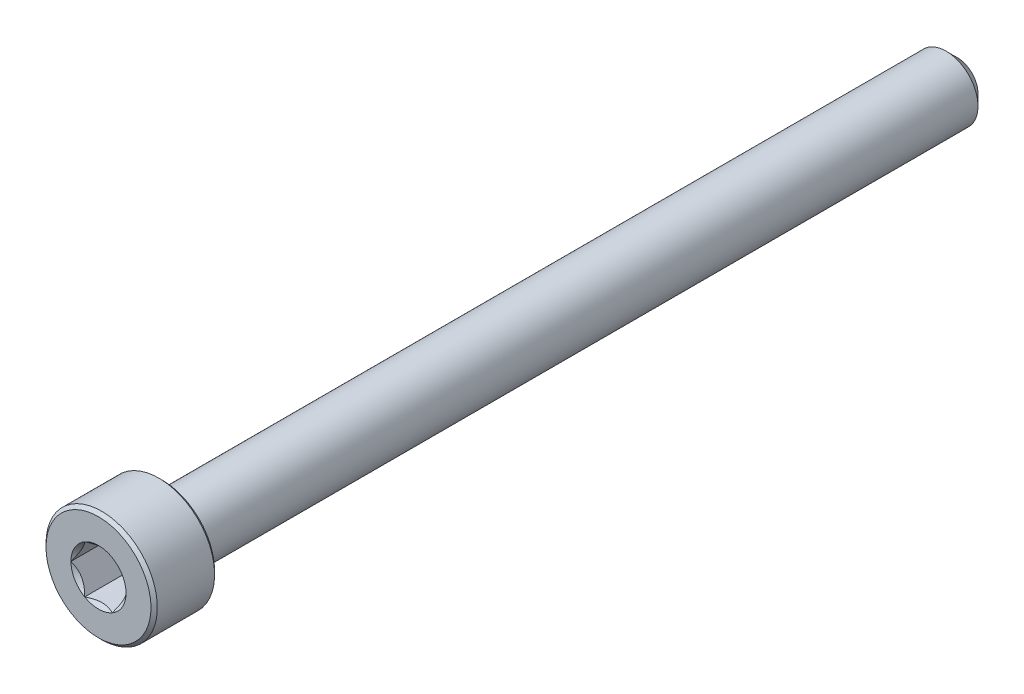
from build123d import *

# Parameters (mm, degrees)
CUT_EXTRUDE1_DEPTH = 3


with BuildPart() as part:
    # Sketch2 → Revolve1 (revolve)
    with BuildSketch(Plane(origin=(0, 0, 0), x_dir=(0, 0, -1), z_dir=(1, 0, 0)), mode=Mode.PRIVATE) as revolve1_sk:
        Polygon((-27, 0), (-27, 3.3), (-26.8, 3.5), (-23.2, 3.5), (-23, 3.3), (-23, 2), (26.3, 2), (27, 1.3), (27, 0), align=None)
    revolve(revolve1_sk.sketch.rotate(Axis((0, 0, -27), (0, 0, 1)), 90), axis=Axis((0, 0, -27), (0, 0, 1)))

    # Sketch3 → Cut-Extrude1 (cut)
    with BuildSketch(Plane.XY.offset(27)):
        Polygon((0.866025404, 1.5), (-0.866025404, 1.5), (-1.732050808, 0), (-0.866025404, -1.5), (0.866025404, -1.5), (1.732050808, 0), align=None)
    extrude(amount=-CUT_EXTRUDE1_DEPTH, mode=Mode.SUBTRACT)

    # Cut-Extrude2 cone 1 section (through the dimple's axis) → Cut-Extrude2 (revolve, cut)
    with BuildSketch(Plane(origin=(0, 0, 27), x_dir=(0, -1, 0), z_dir=(1, 0, 0))):
        Polygon((0, 0), (1.732050808, 0), (0, 1.732050808), align=None)
    revolve(axis=Axis((0, 0, 27), (0, 0, -1)), mode=Mode.SUBTRACT)


solid = part.part
